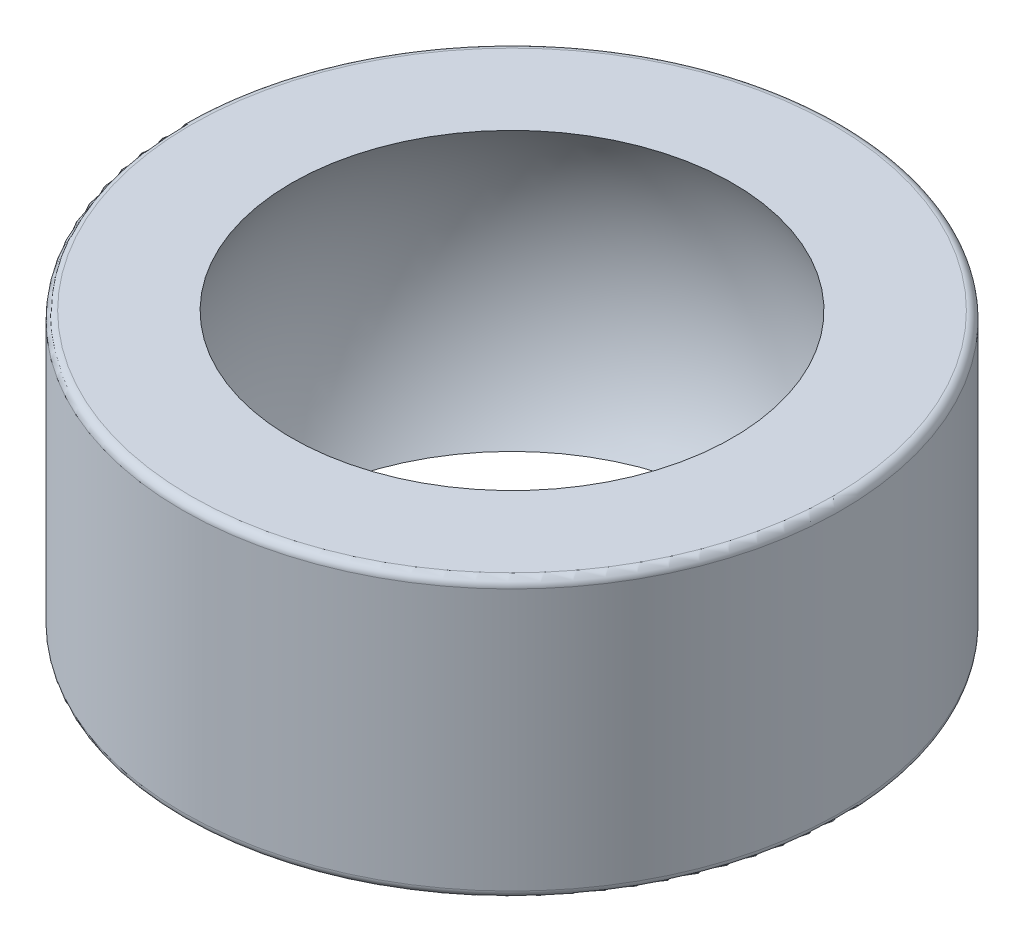
from build123d import *

# Parameters (mm, degrees)
SZKIC1_R                    = 8
DODANIE_WYCI_GNI_CIE1_DEPTH = 3.375
ZAOKR_GLENIE1_R             = 0.2


with BuildPart() as part:
    # Szkic1 → Dodanie-wyciągnięcie1 (new, symmetric)
    with BuildSketch(Plane(origin=(0, 0, 0), x_dir=(1, 0, 0), z_dir=(0, 1, 0))):
        with Locations(Location((0, 0, 0), (0, 0, 270))):
            Circle(SZKIC1_R)
    extrude(amount=DODANIE_WYCI_GNI_CIE1_DEPTH, both=True)

    # Szkic3 → Wycięcie-obrót1 (revolve, cut)
    with BuildSketch(Plane.XY):
        with BuildLine():
            Line((0, -6.33), (0, 6.33))
            ThreePointArc((0, 6.33), (6.33, 0), (0, -6.33))
        make_face()
    revolve(axis=Axis((0, -6.33, 0), (0, 1, 0)), mode=Mode.SUBTRACT)

    # Zaokrąglenie1
    zaokr_glenie1_edges = [part.edges().sort_by_distance(p)[0] for p in [
        (0, -3.375, -8),
        (0, 3.375, -8),
    ]]
    fillet(zaokr_glenie1_edges, radius=ZAOKR_GLENIE1_R)


solid = part.part
